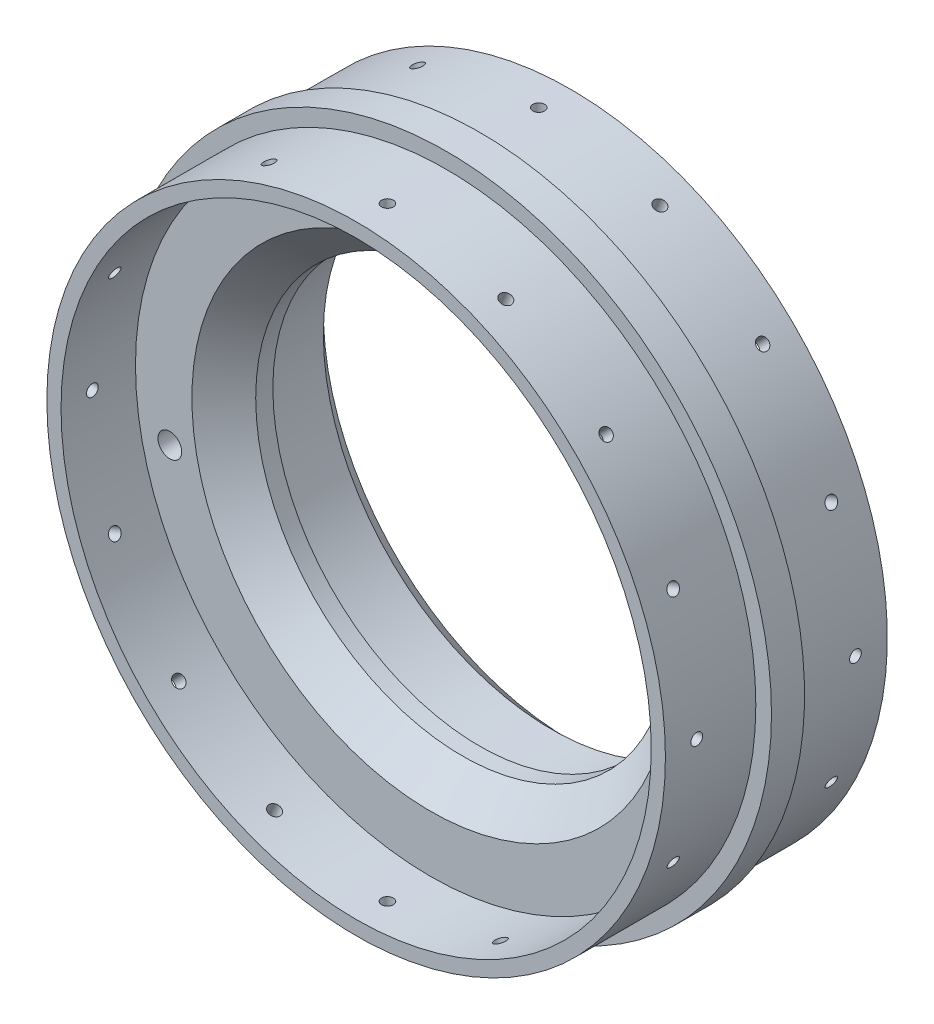
from build123d import *

# Parameters (mm, degrees)
SKETCH5_R                       = 69.85
EXTRUDE1_DEPTH                  = 46.101
SKETCH8_R                       = 44.45
EXTRUDE4_DEPTH                  = 110.010766445
SKETCH6_OUTSIDE_W               = 182.274
SKETCH6_OUTSIDE_H               = 182.274
SKETCH6_OUTSIDE_R               = 66.4845
EXTRUDE2_DEPTH                  = 19.431
SKETCH7_R                       = 63.4365
EXTRUDE3_DEPTH                  = 16.002
CHAMFER1_SIZE                   = 6.858
SKETCH9_OUTSIDE_W               = 182.274
SKETCH9_OUTSIDE_H               = 182.274
SKETCH9_OUTSIDE_R               = 68.0847
EXTRUDE5_DEPTH                  = 19.558
SKETCH10_R                      = 65.0367
SKETCH10_R_2                    = 53.7845
EXTRUDE6_DEPTH                  = 9.525
SKETCH11_R                      = 49.0855
EXTRUDE7_DEPTH                  = 19.558
CHAMFER2_SIZE                   = 4.064
CIRPATTERN1_COUNT               = 16
F_21_0_159_DIAMETER_HOLE1_D     = 4.0386
F_21_0_159_DIAMETER_HOLE1_DEPTH = 12.7
F_21_0_159_DIAMETER_HOLE1_TIP   = 1.213317848
F_7_0_201_DIAMETER_HOLE1_D      = 5.1054
CIRPATTERN2_COUNT               = 2


with BuildPart() as part:
    # Sketch5 → Extrude1 (new body)
    with BuildSketch(Plane.XY):
        Circle(SKETCH5_R)
    extrude(amount=EXTRUDE1_DEPTH)

    # Sketch8 → Extrude4 (cut, through all)
    with BuildSketch(Plane.XY.offset(46.101)):
        Circle(SKETCH8_R)
    extrude(amount=-EXTRUDE4_DEPTH, mode=Mode.SUBTRACT)

    # Sketch6 outside → Extrude2 (cut)
    with BuildSketch(Plane.XY.offset(46.101)):
        Rectangle(SKETCH6_OUTSIDE_W, SKETCH6_OUTSIDE_H)
        Circle(SKETCH6_OUTSIDE_R, mode=Mode.SUBTRACT)
    extrude(amount=-EXTRUDE2_DEPTH, mode=Mode.SUBTRACT)

    # Sketch7 → Extrude3 (cut)
    with BuildSketch(Plane.XY.offset(46.101)):
        Circle(SKETCH7_R)
    extrude(amount=-EXTRUDE3_DEPTH, mode=Mode.SUBTRACT)

    # Chamfer1
    chamfer1_edges = [part.edges().sort_by_distance(p)[0] for p in [
        (-44.45, 0, 30.099),
    ]]
    chamfer(chamfer1_edges, length=CHAMFER1_SIZE)

    # Sketch9 outside → Extrude5 (cut)
    with BuildSketch(Plane(origin=(0, 0, 0), x_dir=(-1, 0, 0), z_dir=(0, 0, -1))):
        Rectangle(SKETCH9_OUTSIDE_W, SKETCH9_OUTSIDE_H)
        Circle(SKETCH9_OUTSIDE_R, mode=Mode.SUBTRACT)
    extrude(amount=-EXTRUDE5_DEPTH, mode=Mode.SUBTRACT)

    # Sketch10 → Extrude6 (cut)
    with BuildSketch(Plane(origin=(0, 0, 0), x_dir=(-1, 0, 0), z_dir=(0, 0, -1))):
        Circle(SKETCH10_R)
        Circle(SKETCH10_R_2, mode=Mode.SUBTRACT)
    extrude(amount=-EXTRUDE6_DEPTH, mode=Mode.SUBTRACT)

    # Sketch11 → Extrude7 (cut)
    with BuildSketch(Plane(origin=(0, 0, 0), x_dir=(-1, 0, 0), z_dir=(0, 0, -1))):
        Circle(SKETCH11_R)
    extrude(amount=-EXTRUDE7_DEPTH, mode=Mode.SUBTRACT)

    # Chamfer2
    chamfer2_edges = [part.edges().sort_by_distance(p)[0] for p in [
        (49.0855, 0, 0),
    ]]
    chamfer(chamfer2_edges, length=CHAMFER2_SIZE)

    # Sketch19 → #39 (0.0995) Diameter Hole2 (revolve, cut)
    with BuildSketch(Plane(origin=(0, 68.0847, 6.858), x_dir=(0, 0, 1), z_dir=(1, 0, 0))):
        Polygon((0, 0), (0, 13.459277521), (1.26365, 12.7), (1.26365, 0), align=None)
    f_39_0_0995_diameter_hole2 = revolve(axis=Axis((0, 74.4347, 6.858), (0, -1, 0)), mode=Mode.SUBTRACT)

    # Sketch25 → #39 (0.0995) Diameter Hole6 (revolve, cut)
    with BuildSketch(Plane(origin=(0, 66.4845, 39.37), x_dir=(0, 0, 1), z_dir=(1, 0, 0))):
        Polygon((0, 0), (0, 13.459277521), (1.26365, 12.7), (1.26365, 0), align=None)
    f_39_0_0995_diameter_hole6 = revolve(axis=Axis((0, 72.8345, 39.37), (0, -1, 0)), mode=Mode.SUBTRACT)

    # CirPattern1: #39 (0.0995) Diameter Hole2, #39 (0.0995) Diameter Hole6 ×16 about axis
    cirpattern1_axis = Axis((0, 0, 19.558), (0, 0, -1))
    add([f_39_0_0995_diameter_hole2.rotate(cirpattern1_axis, i * 360 / CIRPATTERN1_COUNT) for i in range(1, CIRPATTERN1_COUNT)], mode=Mode.SUBTRACT)
    add([f_39_0_0995_diameter_hole6.rotate(cirpattern1_axis, i * 360 / CIRPATTERN1_COUNT) for i in range(1, CIRPATTERN1_COUNT)], mode=Mode.SUBTRACT)

    # #21 (0.159) Diameter Hole1
    with Locations(Plane(origin=(13.627058993, -68.507851836, 23.114), x_dir=(0.9807852804032304, 0.19509032201612872, 0), z_dir=(0.1950903220161287, -0.9807852804032303, 0))):
        with Locations((0, 0)):
            Hole(F_21_0_159_DIAMETER_HOLE1_D / 2, depth=F_21_0_159_DIAMETER_HOLE1_DEPTH)
            with Locations((0, 0, -(F_21_0_159_DIAMETER_HOLE1_DEPTH + F_21_0_159_DIAMETER_HOLE1_TIP / 2))):  # 118° drill point
                Cone(0, F_21_0_159_DIAMETER_HOLE1_D / 2, F_21_0_159_DIAMETER_HOLE1_TIP, mode=Mode.SUBTRACT)

    # #7 (0.201) Diameter Hole1 (through all)
    with Locations(Plane(origin=(56.051878775, 11.149411903, 30.099), x_dir=(1, 0, 0), z_dir=(0, 0, 1))):
        with Locations((0, 0)):
            f_7_0_201_diameter_hole1 = Hole(F_7_0_201_DIAMETER_HOLE1_D / 2)

    # CirPattern2: #7 (0.201) Diameter Hole1 ×2 about axis
    cirpattern2_axis = Axis((0, 0, 0), (0, 0, 1))
    for i in range(1, CIRPATTERN2_COUNT):
        add(f_7_0_201_diameter_hole1.rotate(cirpattern2_axis, i * 360 / CIRPATTERN2_COUNT), mode=Mode.SUBTRACT)


solid = part.part
